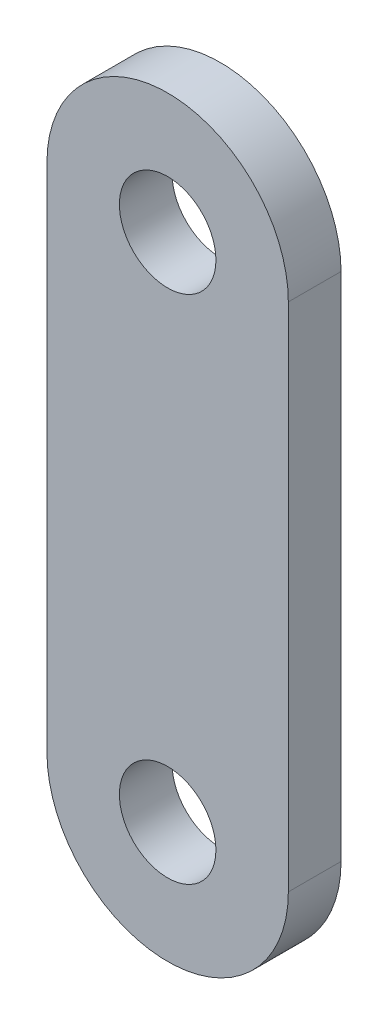
from build123d import *

# Parameters (mm, degrees)
SKETCH_1_R      = 1.2
EXTRUDE_1_DEPTH = 1.31


with BuildPart() as part:
    # 草图1 → 凸台-拉伸1 (new body)
    with BuildSketch(Plane.XY):
        with BuildLine():
            Line((-3, -6.35), (-3, 6.35))
            ThreePointArc((-3, 6.35), (0, 9.35), (3, 6.35))
            Line((3, 6.35), (3, -6.35))
            ThreePointArc((3, -6.35), (0, -9.35), (-3, -6.35))
        make_face()
        with Locations((0, 6.35)):
            Circle(SKETCH_1_R, mode=Mode.SUBTRACT)
        with Locations((0, -6.35)):
            Circle(SKETCH_1_R, mode=Mode.SUBTRACT)
    extrude(amount=EXTRUDE_1_DEPTH)


solid = part.part
